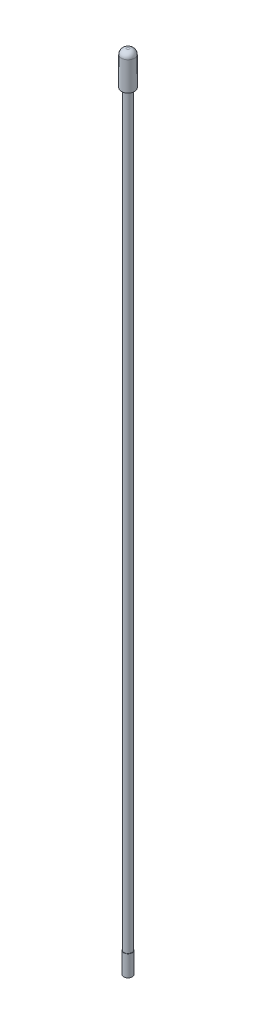
from build123d import *

# Parameters (mm, degrees)
SKETCH2_R           = 1.625
BOSS_EXTRUDE2_DEPTH = 8
SKETCH4_R           = 1.5
BOSS_EXTRUDE3_DEPTH = 285
SKETCH5_R           = 2.5
BOSS_EXTRUDE4_DEPTH = 13
FILLET1_R           = 2


with BuildPart() as part:
    # Sketch2 → Boss-Extrude2 (new body)
    with BuildSketch(Plane(origin=(0, 0, 0), x_dir=(1, 0, 0), z_dir=(0, 1, 0))):
        with Locations(Location((0, 0, 0), (0, 0, 270))):
            Circle(SKETCH2_R)
    extrude(amount=BOSS_EXTRUDE2_DEPTH)

    # Sketch4 → Boss-Extrude3 (add)
    with BuildSketch(Plane(origin=(0, 8, 0), x_dir=(1, 0, 0), z_dir=(0, 1, 0))):
        with Locations(Location((0, 0, 0), (0, 0, 270))):
            Circle(SKETCH4_R)
    extrude(amount=BOSS_EXTRUDE3_DEPTH)

    # Sketch5 → Boss-Extrude4 (add)
    with BuildSketch(Plane(origin=(0, 293, 0), x_dir=(1, 0, 0), z_dir=(0, 1, 0))):
        with Locations(Location((0, 0, 0), (0, 0, 270))):
            Circle(SKETCH5_R)
    extrude(amount=BOSS_EXTRUDE4_DEPTH)

    # Fillet1
    fillet1_edges = [part.edges().sort_by_distance(p)[0] for p in [
        (0, 306, -2.5),
    ]]
    fillet(fillet1_edges, radius=FILLET1_R)


solid = part.part
